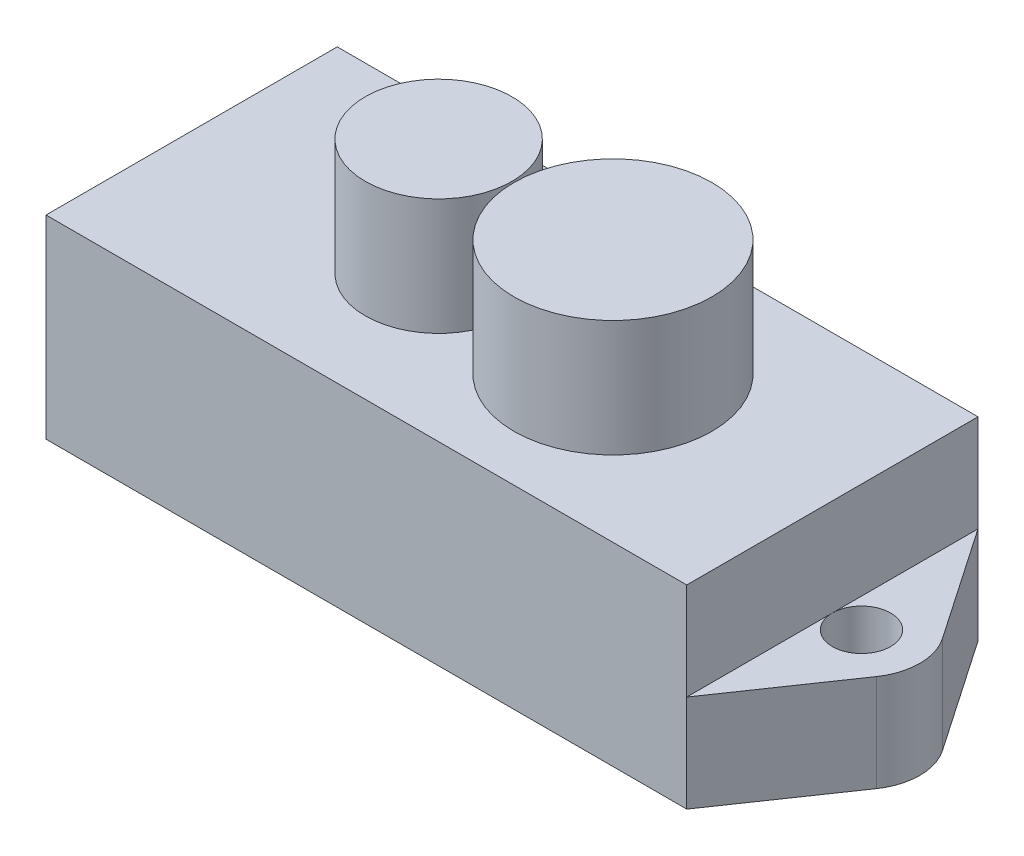
from build123d import *

# Parameters (mm, degrees)
BOSS_EXTRUDE11_DEPTH   = 5
BOSS_EXTRUDE11_2_DEPTH = 5
SKETCH1_5_W            = 33
SKETCH1_5_H            = 15
BOSS_EXTRUDE13_DEPTH   = 10
SKETCH2_R              = 1.5
CUT_EXTRUDE1_DEPTH     = 5
SKETCH3_R              = 3.777846651
BOSS_EXTRUDE18_DEPTH   = 6
SKETCH3_5_R            = 5.1
BOSS_EXTRUDE22_DEPTH   = 6


with BuildPart() as part:
    # Sketch1 → Boss-Extrude11 (new body)
    with BuildSketch(Plane(origin=(0, 0, 0), x_dir=(1, 0, 0), z_dir=(0, 1, 0))):
        with BuildLine():
            Line((-16.5, -7.5), (-16.5, 7.5))
            Line((-16.5, 7.5), (-20.475239861, 1.695047972))
            ThreePointArc((-20.475239861, 1.695047972), (-21, 0), (-20.475239861, -1.695047972))
            Line((-20.475239861, -1.695047972), (-16.5, -7.5))
        make_face()
    extrude(amount=BOSS_EXTRUDE11_DEPTH)



with BuildPart() as body_2:
    # Sketch1 → Boss-Extrude11 2 (new body)
    with BuildSketch(Plane(origin=(0, 0, 0), x_dir=(1, 0, 0), z_dir=(0, 1, 0))):
        with BuildLine():
            Line((20.475239861, 1.695047972), (16.5, 7.5))
            Line((16.5, 7.5), (16.5, -7.5))
            Line((16.5, -7.5), (20.475239861, -1.695047972))
            ThreePointArc((20.475239861, -1.695047972), (21, 0), (20.475239861, 1.695047972))
        make_face()
    extrude(amount=BOSS_EXTRUDE11_2_DEPTH)


with BuildPart() as part_1:
    add(part.part)

    add(body_2.part)  # Boss-Extrude13 merges body 2
    # Sketch1<5> → Boss-Extrude13 (add)
    with BuildSketch(Plane(origin=(0, 0, 0), x_dir=(1, 0, 0), z_dir=(0, 1, 0))):
        Rectangle(SKETCH1_5_W, SKETCH1_5_H)
    extrude(amount=BOSS_EXTRUDE13_DEPTH)

    # Sketch2 → Cut-Extrude1 (cut)
    with BuildSketch(Plane(origin=(0, 5, 0), x_dir=(1, 0, 0), z_dir=(0, 1, 0))):
        with Locations((-18, 0)):
            Circle(SKETCH2_R)
        with Locations((18, 0)):
            Circle(SKETCH2_R)
    extrude(amount=-CUT_EXTRUDE1_DEPTH, mode=Mode.SUBTRACT)

    # Sketch3 → Boss-Extrude18 (add)
    with BuildSketch(Plane(origin=(0, 10, 0), x_dir=(1, 0, 0), z_dir=(0, 1, 0))):
        with Locations((-3.777846651, 0)):
            Circle(SKETCH3_R)
    extrude(amount=BOSS_EXTRUDE18_DEPTH)

    # Sketch3<5> → Boss-Extrude22 (add)
    with BuildSketch(Plane(origin=(0, 10, 0), x_dir=(1, 0, 0), z_dir=(0, 1, 0))):
        with Locations((5.2, 0)):
            Circle(SKETCH3_5_R)
    extrude(amount=BOSS_EXTRUDE22_DEPTH)


solid = part_1.part
